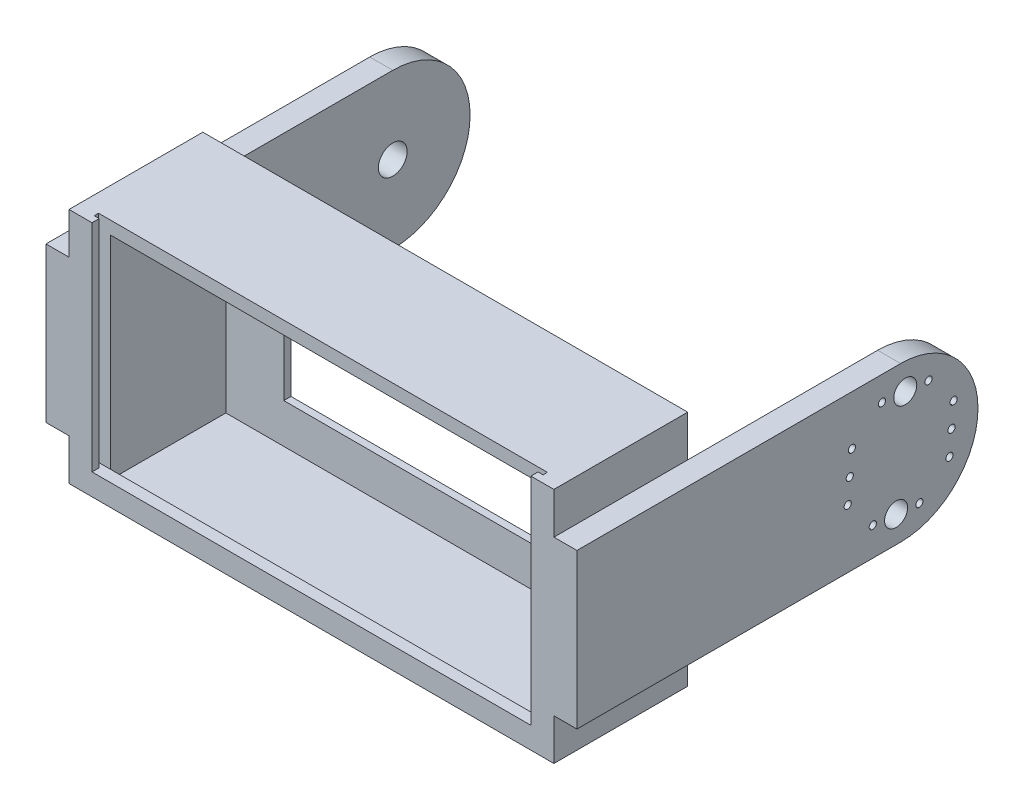
from build123d import *

# Parameters (mm, degrees)
SKETCH_2_R          = 1.6
SKETCH_2_R_2        = 0.5
BOSS_EXTRUDE1_DEPTH = 3.2
SKETCH1_W           = 18.6
SKETCH1_H           = 33
SKETCH1_W_2         = 16
SKETCH1_H_2         = 29.4
BOSS_EXTRUDE2_DEPTH = 67.4
CUT_EXTRUDE1_REACH  = 116.482
SKETCH2_W           = 42.896922538
SKETCH2_H           = 18.367032987
CUT_EXTRUDE2_REACH  = 123.795
SKETCH3_W           = 27
SKETCH3_H           = 17
BOSS_EXTRUDE3_START = 3.2
BOSS_EXTRUDE3_DEPTH = 3.2
SKETCH5_R           = 2
CUT_EXTRUDE3_DEPTH  = 10
SKETCH6_W           = 16
SKETCH6_H           = 29.4
BOSS_EXTRUDE4_DEPTH = 4.2
SKETCH7_W           = 16
SKETCH7_H           = 29.4
BOSS_EXTRUDE5_DEPTH = 4.2
CUT_EXTRUDE5_DEPTH  = 30


with BuildPart() as part:
    # 스케치2 → Boss-Extrude1 (new body)
    with BuildSketch(Plane(origin=(62.38287134, 0, 0), x_dir=(0, 0, -1), z_dir=(1, 0, 0))):
        with BuildLine():
            Line((-65.677419436, 80.41810471), (-110.677419436, 80.41810471))
            Line((-110.677419436, 80.41810471), (-110.677419436, 58.91810471))
            Line((-110.677419436, 58.91810471), (-65.677419436, 58.91810471))
            ThreePointArc((-65.677419436, 58.91810471), (-54.927419436, 69.66810471), (-65.677419436, 80.41810471))
        make_face()
        with Locations((-66.314714345, 62.596764299)):
            Circle(SKETCH_2_R, mode=Mode.SUBTRACT)
        with Locations((-61.803243354, 76.447725619)):
            Circle(SKETCH_2_R_2, mode=Mode.SUBTRACT)
        with Locations((-68.277005701, 77.03116462)):
            Circle(SKETCH_2_R_2, mode=Mode.SUBTRACT)
        with Locations((-72.457040346, 73.542280792)):
            Circle(SKETCH_2_R_2, mode=Mode.SUBTRACT)
        with Locations((-72.748759847, 70.305399618)):
            Circle(SKETCH_2_R_2, mode=Mode.SUBTRACT)
        with Locations((-73.040479347, 67.068518444)):
            Circle(SKETCH_2_R_2, mode=Mode.SUBTRACT)
        with Locations((-69.551595519, 62.8884838)):
            Circle(SKETCH_2_R_2, mode=Mode.SUBTRACT)
        with Locations((-63.077833171, 62.305044799)):
            Circle(SKETCH_2_R_2, mode=Mode.SUBTRACT)
        with Locations((-58.897798526, 65.793928627)):
            Circle(SKETCH_2_R_2, mode=Mode.SUBTRACT)
        with Locations((-58.606079026, 69.030809801)):
            Circle(SKETCH_2_R_2, mode=Mode.SUBTRACT)
        with Locations((-58.314359525, 72.267690975)):
            Circle(SKETCH_2_R_2, mode=Mode.SUBTRACT)
        with Locations((-65.040124528, 76.73944512)):
            Circle(SKETCH_2_R, mode=Mode.SUBTRACT)
    extrude(amount=BOSS_EXTRUDE1_DEPTH)

    # Sketch1 → Boss-Extrude2 (add)
    with BuildSketch(Plane.ZY.offset(-62.38287134)):
        with Locations((101.377419436, 69.66810471)):
            Rectangle(SKETCH1_W, SKETCH1_H)
        with Locations((101.077419436, 69.66810471)):
            Rectangle(SKETCH1_W_2, SKETCH1_H_2, mode=Mode.SUBTRACT)
    extrude(amount=BOSS_EXTRUDE2_DEPTH)

    # Sketch2 → Cut-Extrude1 (cut, up to next)
    with BuildSketch(Plane(origin=(0, 0, 92.077419436), x_dir=(-1, 0, 0), z_dir=(0, 0, -1)), mode=Mode.PRIVATE) as cut_extrude1_sk1:
        with Locations((-28.68287134, 69.668104709)):
            Rectangle(SKETCH2_W, SKETCH2_H)
    cut_extrude1_tool1 = extrude(cut_extrude1_sk1.sketch, amount=-CUT_EXTRUDE1_REACH, mode=Mode.PRIVATE) & part.part
    add(cut_extrude1_tool1.solids().sort_by_distance((28.682871, 69.668105, 92.077419))[0], mode=Mode.SUBTRACT)

    # Sketch3 → Cut-Extrude2 (cut, up to next)
    with BuildSketch(Plane.XY.offset(110.677419436), mode=Mode.PRIVATE) as cut_extrude2_sk1:
        with Locations((28.68287134, 69.66810471)):
            Rectangle(SKETCH3_W, SKETCH3_H)
    cut_extrude2_tool1 = extrude(cut_extrude2_sk1.sketch, amount=-CUT_EXTRUDE2_REACH, mode=Mode.PRIVATE) & part.part
    add(cut_extrude2_tool1.solids().sort_by_distance((28.682871, 69.668105, 110.677419))[0], mode=Mode.SUBTRACT)

    # Sketch4 → Boss-Extrude3 (add)
    with BuildSketch(Plane.ZY.offset(5.01712866).offset(BOSS_EXTRUDE3_START)):
        with BuildLine():
            Line((65.677419436, 80.41810471), (110.677419436, 80.41810471))
            Line((110.677419436, 80.41810471), (110.677419436, 58.91810471))
            Line((110.677419436, 58.91810471), (65.677419436, 58.91810471))
            ThreePointArc((65.677419436, 58.91810471), (54.927419436, 69.66810471), (65.677419436, 80.41810471))
        make_face()
    extrude(amount=-BOSS_EXTRUDE3_DEPTH)

    # Sketch5 → Cut-Extrude3 (cut)
    with BuildSketch(Plane.ZY.offset(8.21712866)):
        with Locations((65.677419436, 69.66810471)):
            Circle(SKETCH5_R)
    extrude(amount=-CUT_EXTRUDE3_DEPTH, mode=Mode.SUBTRACT)

    # Sketch6 → Boss-Extrude4 (add)
    with BuildSketch(Plane(origin=(62.38287134, 0, 0), x_dir=(0, 0, -1), z_dir=(1, 0, 0))):
        with Locations((-101.077419436, 69.66810471)):
            Rectangle(SKETCH6_W, SKETCH6_H)
    extrude(amount=-BOSS_EXTRUDE4_DEPTH)

    # Sketch7 → Boss-Extrude5 (add)
    with BuildSketch(Plane.ZY.offset(5.01712866)):
        with Locations((101.077419436, 69.66810471)):
            Rectangle(SKETCH7_W, SKETCH7_H)
    extrude(amount=-BOSS_EXTRUDE5_DEPTH)

    # Sketch10 → Cut-Extrude5 (cut)
    with BuildSketch(Plane(origin=(0, 86.16810471, 0), x_dir=(1, 0, 0), z_dir=(0, 1, 0))):
        Polygon((-1.81712866, -110.677419436), (59.18287134, -110.677419436), (59.18287134, -109.677419436), (59.88287134, -109.677419436), (59.88287134, -109.077419436), (-2.51712866, -109.077419436), (-2.51712866, -109.677419436), (-1.81712866, -109.677419436), align=None)
    extrude(amount=-CUT_EXTRUDE5_DEPTH, mode=Mode.SUBTRACT)


solid = part.part
